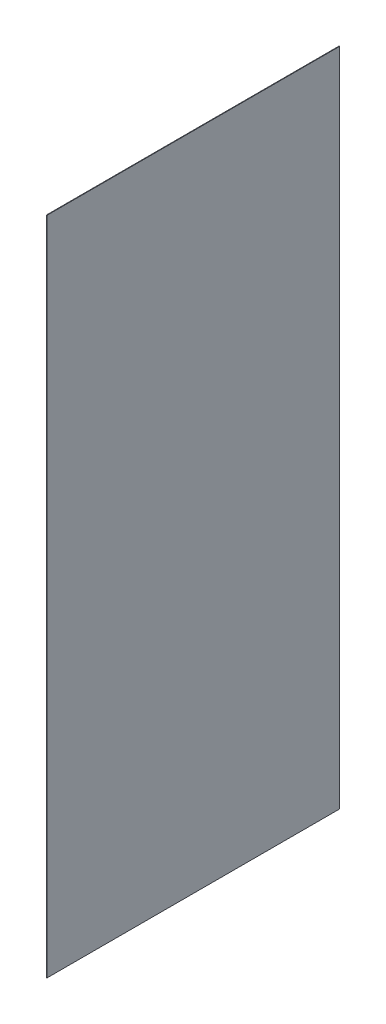
from build123d import *

# Parameters (mm, degrees)
SKETCH1_W                = 1.5
SKETCH1_H                = 1850
PACK_DIS_YAN_SOL_1_DEPTH = 820


with BuildPart() as part:
    # Sketch1 → PACK_dis_yan_sol_1 (new body)
    with BuildSketch(Plane.XY):
        with Locations((0.75, 1045)):
            Rectangle(SKETCH1_W, SKETCH1_H)
    extrude(amount=-PACK_DIS_YAN_SOL_1_DEPTH)


solid = part.part
